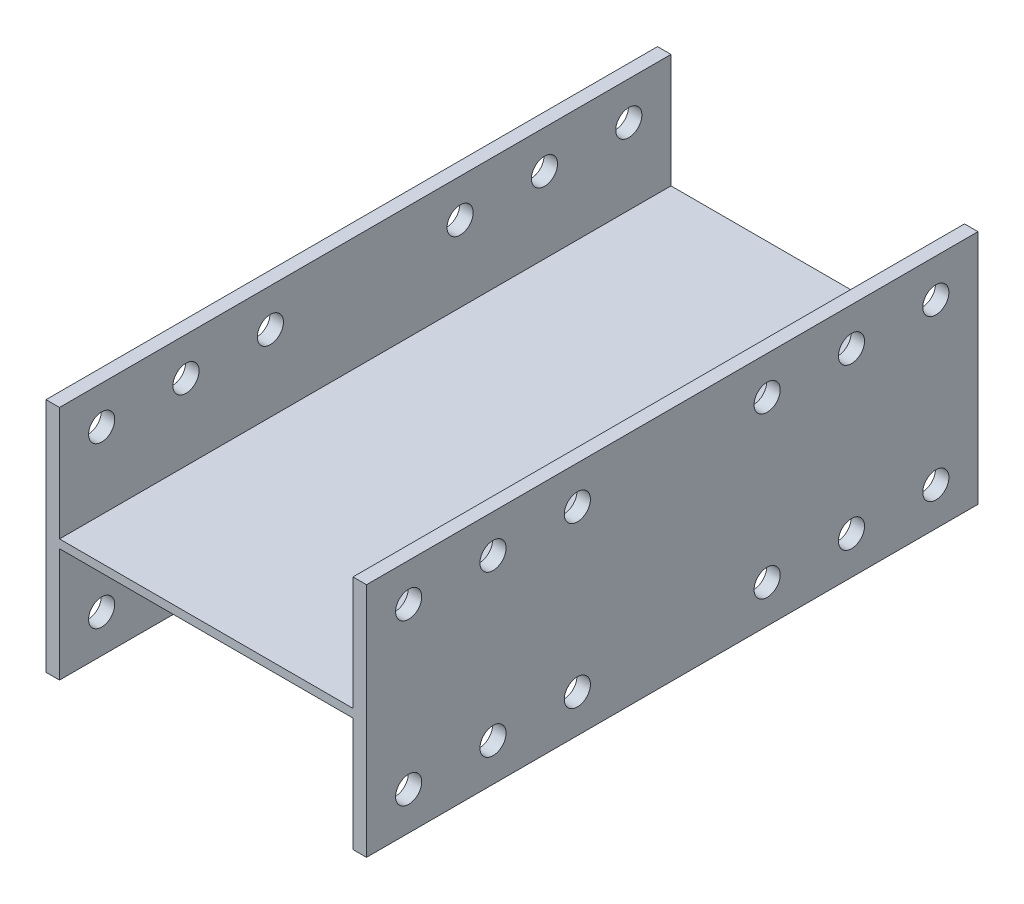
from build123d import *

# Parameters (mm, degrees)
EXTRUDE_1_DEPTH          = 362.5
CUT_EXTRUDE_2_DEPTH      = 433.557799606
CUT_EXTRUDE_2_DEPTH_BACK = 433.557799606
SKETCH_3_R               = 15.5


with BuildPart() as part:
    # 草图1 → 拉伸1 (new, symmetric)
    with BuildSketch(Plane.XY):
        Polygon((-174, 140), (-190, 140), (-190, -140), (-174, -140), (-174, -5), (174, -5), (174, -140), (190, -140), (190, 140), (174, 140), (174, 5), (-174, 5), align=None)
    extrude(amount=EXTRUDE_1_DEPTH, both=True)

    # 草图3 → 拉伸2 (cut, two sides: drawn at the far end of the back side and taken through both)
    with BuildSketch(Plane(origin=(0, 0, 0), x_dir=(0, 0, -1), z_dir=(1, 0, 0)).offset(-CUT_EXTRUDE_2_DEPTH_BACK)):
        with Locations((-312.5, 95)):
            Circle(SKETCH_3_R)
        with Locations((-212.5, 95)):
            Circle(SKETCH_3_R)
        with Locations((-112.5, 95)):
            Circle(SKETCH_3_R)
        with Locations(Location((-112.5, -95, 0), (0, 0, 270))):
            Circle(SKETCH_3_R)
        with Locations(Location((-212.5, -95, 0), (0, 0, 270))):
            Circle(SKETCH_3_R)
        with Locations(Location((-312.5, -95, 0), (0, 0, 270))):
            Circle(SKETCH_3_R)
        with Locations((312.5, -95)):
            Circle(SKETCH_3_R)
        with Locations((212.5, -95)):
            Circle(SKETCH_3_R)
        with Locations((112.5, -95)):
            Circle(SKETCH_3_R)
        with Locations(Location((112.5, 95, 0), (0, 0, 180))):
            Circle(SKETCH_3_R)
        with Locations(Location((212.5, 95, 0), (0, 0, 180))):
            Circle(SKETCH_3_R)
        with Locations(Location((312.5, 95, 0), (0, 0, 180))):
            Circle(SKETCH_3_R)
    extrude(amount=CUT_EXTRUDE_2_DEPTH + CUT_EXTRUDE_2_DEPTH_BACK, mode=Mode.SUBTRACT)


solid = part.part
